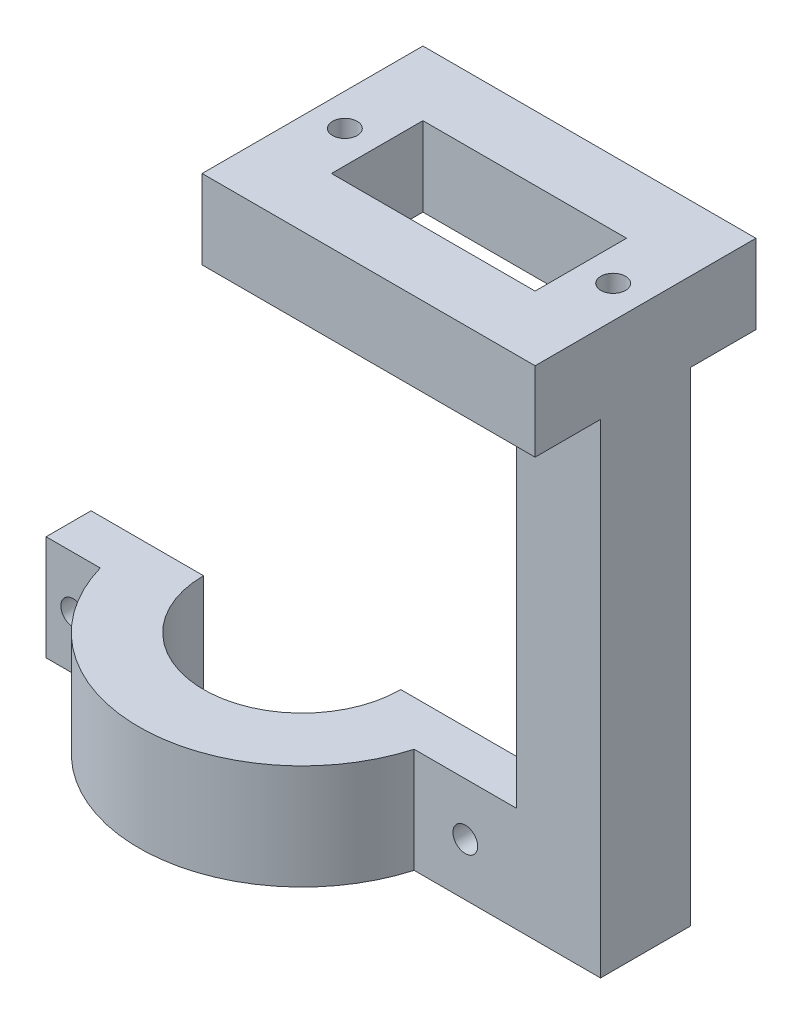
from build123d import *

# Parameters (mm, degrees)
SKETCH_1_W           = 51.5
SKETCH_1_H           = 34.15
SKETCH_1_W_2         = 31.5
SKETCH_1_H_2         = 14.15
EXTRUDE_1_DEPTH      = 12.25
SKETCH_2_R           = 1.91
CUT_EXTRUDE_1_DEPTH  = 34.236736076
SKETCH_4_W           = 13
SKETCH_4_H           = 13.91
EXTRUDE_1_2_DEPTH    = 74.82
SKETCH_5_W           = 13.91
SKETCH_5_H           = 16.23
EXTRUDE_2_DEPTH      = 16
SKETCH_7_R           = 25.25
SKETCH_7_R_2         = 15.25
EXTRUDE_2_2_DEPTH    = 16.23
SKETCH_15_R          = 1.91
CUT_EXTRUDE_6_DEPTH  = 97.964478439
SKETCH_16_W          = 13.91
SKETCH_16_H          = 16.23
EXTRUDE_4_DEPTH      = 10
SKETCH_17_R          = 1.91
CUT_EXTRUDE_7_DEPTH  = 102.16913771
SKETCH_23_W          = 89.330713517
SKETCH_23_H          = 36.104783584
CUT_EXTRUDE_12_DEPTH = 57


with BuildPart() as part:
    # 草圖1 → Extrude 1 (new body)
    with BuildSketch(Plane(origin=(0, 0, 0), x_dir=(1, 0, 0), z_dir=(0, 1, 0))):
        Rectangle(SKETCH_1_W, SKETCH_1_H)
        Rectangle(SKETCH_1_W_2, SKETCH_1_H_2, mode=Mode.SUBTRACT)
    extrude(amount=EXTRUDE_1_DEPTH)

    # 草圖2 → 除料-伸長1 (cut, through all)
    with BuildSketch(Plane(origin=(0, 12.25, 0), x_dir=(1, 0, 0), z_dir=(0, 1, 0))):
        with Locations(Location((-20.75, 0, 0), (0, 0, 270))):
            Circle(SKETCH_2_R)
        with Locations(Location((20.75, 0, 0), (0, 0, 270))):
            Circle(SKETCH_2_R)
    extrude(amount=-CUT_EXTRUDE_1_DEPTH, mode=Mode.SUBTRACT)

    # 草圖4 → Extrude 1 2 (add)
    with BuildSketch(Plane.XZ):
        with Locations((19.25, 0)):
            Rectangle(SKETCH_4_W, SKETCH_4_H)
    extrude(amount=EXTRUDE_1_2_DEPTH)

    # 草圖5 → Extrude 2 (add)
    with BuildSketch(Plane.ZY.offset(-12.75)):
        with Locations((0, -66.705)):
            Rectangle(SKETCH_5_W, SKETCH_5_H)
    extrude(amount=EXTRUDE_2_DEPTH)

    # 草圖7 → Extrude 2 2 (add)
    with BuildSketch(Plane(origin=(3.626674765, -74.82, 0), x_dir=(1, 0, 0), z_dir=(0, -1, 0))):
        with Locations((-30.978154344, 0)):
            Circle(SKETCH_7_R)
        with Locations((-30.978154344, 0)):
            Circle(SKETCH_7_R_2, mode=Mode.SUBTRACT)
    extrude(amount=-EXTRUDE_2_2_DEPTH)

    # 草圖15 → 除料-伸長6 (cut, through all)
    with BuildSketch(Plane(origin=(0, 0, -6.955), x_dir=(-1, 0, 0), z_dir=(0, 0, -1))):
        with Locations((-4.835883248, -66.705)):
            Circle(SKETCH_15_R)
    extrude(amount=-CUT_EXTRUDE_6_DEPTH, mode=Mode.SUBTRACT)

    # 草圖16 → 填料-伸長4 (add)
    with BuildSketch(Plane(origin=(-60, 0, 0), x_dir=(0, 0, -1), z_dir=(1, 0, 0))):
        with Locations((0, -66.705)):
            Rectangle(SKETCH_16_W, SKETCH_16_H)
    extrude(amount=EXTRUDE_4_DEPTH)

    # 草圖17 → 除料-伸長7 (cut, through all)
    with BuildSketch(Plane(origin=(0, 0, -6.955), x_dir=(-1, 0, 0), z_dir=(0, 0, -1))):
        with Locations((55.812362827, -66.705)):
            Circle(SKETCH_17_R)
    extrude(amount=-CUT_EXTRUDE_7_DEPTH, mode=Mode.SUBTRACT)

    # 草圖23 → 除料-伸長12 (cut)
    with BuildSketch(Plane(origin=(0, -58.59, 0), x_dir=(1, 0, 0), z_dir=(0, 1, 0))):
        with Locations((-31.915356759, 18.052391792)):
            Rectangle(SKETCH_23_W, SKETCH_23_H)
    extrude(amount=-CUT_EXTRUDE_12_DEPTH, mode=Mode.SUBTRACT)


solid = part.part
